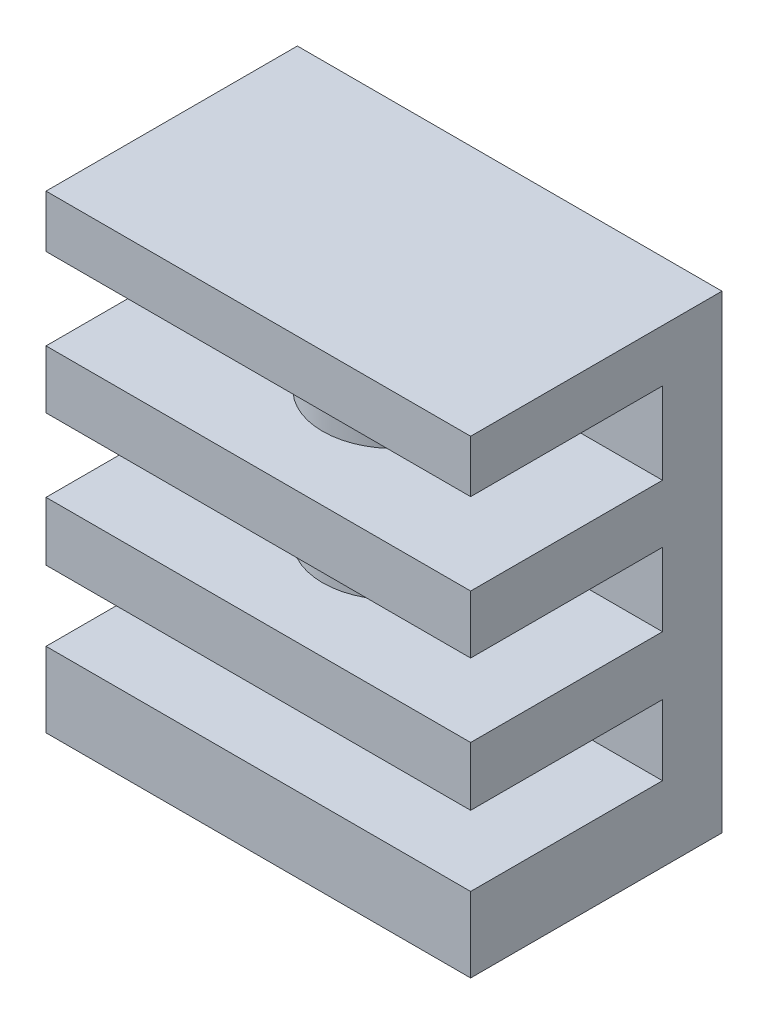
from build123d import *

# Parameters (mm, degrees)
BOSS_EXTRUDE1_DEPTH = 50
SKETCH4_R           = 16.890804547
BOSS_EXTRUDE2_DEPTH = 62.458045


with BuildPart() as part:
    # Sketch2 → Boss-Extrude1 (new, symmetric)
    with BuildSketch(Plane(origin=(0, 0, 0), x_dir=(0, 0, -1), z_dir=(1, 0, 0))):
        Polygon((0, 0), (59.188081664, 0), (59.188081664, 110.495775099), (0, 110.495775099), (0, 98.172971619), (45.177222912, 98.172971619), (45.177222912, 78.929141526), (0, 78.929141526), (0, 65.255893829), (45.177222912, 65.255893829), (45.177222912, 48.037730062), (0, 48.037730062), (0, 34.195676837), (45.177222912, 34.195676837), (45.177222912, 17.652735178), (0, 17.652735178), align=None)
    extrude(amount=BOSS_EXTRUDE1_DEPTH, both=True)

    # Sketch4 → Boss-Extrude2 (add)
    with BuildSketch(Plane(origin=(0, 110.495775099, 0), x_dir=(1, 0, 0), z_dir=(0, 1, 0))):
        with Locations((0, 32.021799432)):
            Circle(SKETCH4_R)
    extrude(amount=-BOSS_EXTRUDE2_DEPTH)


solid = part.part
